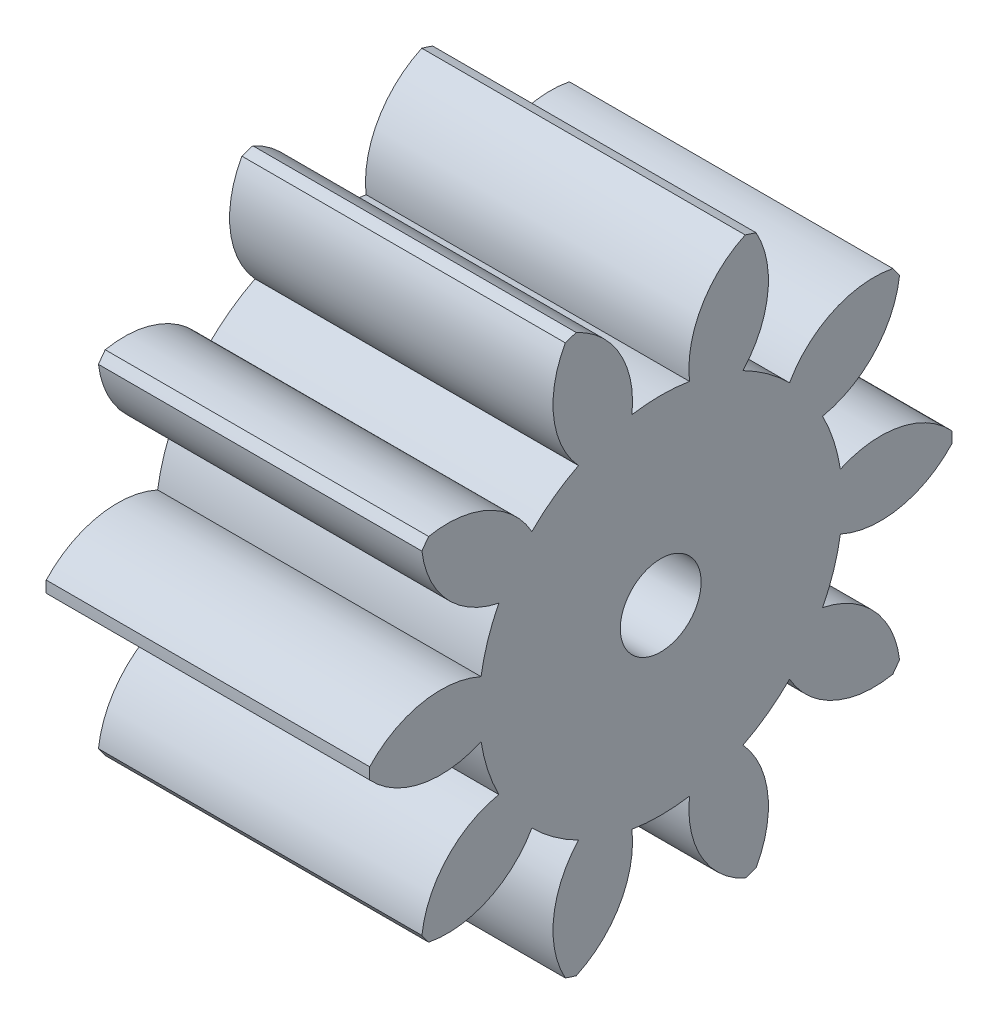
from build123d import *

# Parameters (mm, degrees)
BASPROSKE_W     = 4
BASPROSKE_H     = 3.6
TOOTHCUT_DEPTH  = 7.474565622
TEETHCUTS_COUNT = 10
TEETHCUTS_ANGLE = 324
BORSKE_R        = 0.5
BORE_DEPTH      = 50.0000508


with BuildPart() as part:
    # BasProSke → Base-Revolve (revolve)
    with BuildSketch(Plane(origin=(0, 0, 0), x_dir=(1, 0, 0), z_dir=(0, 1, 0)), mode=Mode.PRIVATE) as base_revolve_sk:
        with Locations((2, 1.8)):
            Rectangle(BASPROSKE_W, BASPROSKE_H)
    revolve(base_revolve_sk.sketch.rotate(Axis((-10, 0, 0), (1, 0, 0)), 180), axis=Axis((-10, 0, 0), (1, 0, 0)))

    # TooCutSke → ToothCut (cut, through all)
    with BuildSketch(Plane(origin=(0, 0, 0), x_dir=(0, 0, -1), z_dir=(1, 0, 0))):
        with BuildLine():
            ThreePointArc((0.355978269, 2.22064866), (0, 2.249), (-0.355978269, 2.22064866))
            ThreePointArc((-0.355978269, 2.22064866), (-0.512117582, 2.960985626), (-1.080212515, 3.460732015))
            ThreePointArc((-1.080212515, 3.460732015), (0, 3.6254), (1.080212515, 3.460732015))
            ThreePointArc((1.080212515, 3.460732015), (0.512117582, 2.960985626), (0.355978269, 2.22064866))
        make_face()
    toothcut = extrude(amount=TOOTHCUT_DEPTH, mode=Mode.SUBTRACT)

    # TeethCuts: ToothCut ×10 about axis
    teethcuts_axis = Axis((-10, 0, 0), (1, 0, 0))
    for i in range(1, TEETHCUTS_COUNT):
        add(toothcut.rotate(teethcuts_axis, i * TEETHCUTS_ANGLE / (TEETHCUTS_COUNT - 1)), mode=Mode.SUBTRACT)

    # BorSke → Bore (cut, symmetric)
    with BuildSketch(Plane(origin=(0, 0, 0), x_dir=(0, 0, -1), z_dir=(1, 0, 0))):
        with Locations(Location((0, 0, 0), (0, 0, 180))):
            Circle(BORSKE_R)
    extrude(amount=BORE_DEPTH, both=True, mode=Mode.SUBTRACT)


solid = part.part
